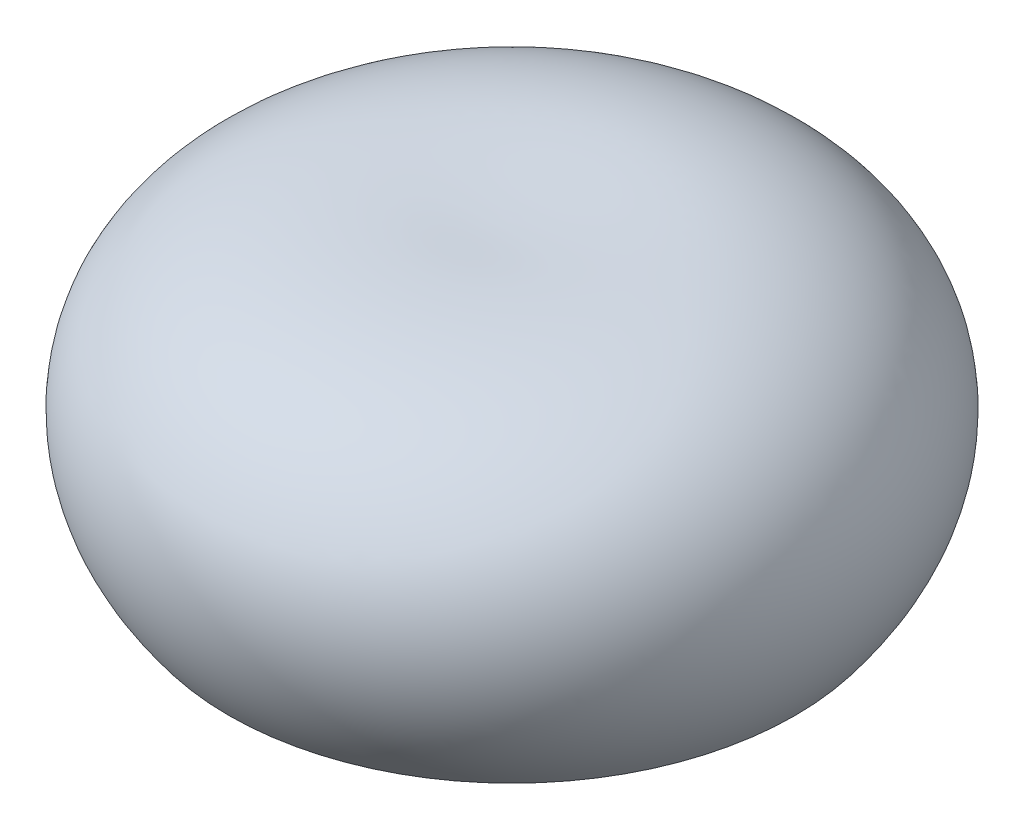
from build123d import *


with BuildPart() as part:
    # 草图1 → 旋转1 (revolve)
    with BuildSketch(Plane.XY):
        with BuildLine():
            Line((0, 7), (0, 0))
            Line((0, 0), (6.831441261, 0))
            add(Edge.make_bspline(
                [(0, 7), (0.073826027, 6.99961248), (0.178309524, 6.999064037), (0.306353289, 7.001245912), (0.380494798, 7.002863842), (0.441570297, 7.004497041), (0.495006805, 7.006121221), (0.543211062, 7.007739734), (0.587527277, 7.009349058), (0.628802834, 7.010947825), (0.667614606, 7.012534752), (0.704377034, 7.01410898), (0.739400045, 7.015669846), (0.772922733, 7.017216861), (0.805134201, 7.018749647), (0.83618711, 7.020267916), (0.866206819, 7.021771443), (0.895297775, 7.023260054), (0.923548095, 7.024733613), (0.951032931, 7.026192009), (0.977816991, 7.027635168), (1.003956462, 7.029063019), (1.029500501, 7.030475521), (1.054492406, 7.031872635), (1.078970545, 7.033254337), (1.10296911, 7.034620614), (1.126518722, 7.035971457), (1.149646932, 7.037306863), (1.172378634, 7.038626836), (1.194736407, 7.039931383), (1.216740809, 7.041220517), (1.238410615, 7.042494251), (1.25976303, 7.0437526), (1.280813862, 7.044995589), (1.301577678, 7.046223234), (1.322067936, 7.047435562), (1.342297094, 7.048632594), (1.362276717, 7.049814357), (1.382017559, 7.050980881), (1.401529643, 7.052132189), (1.420822325, 7.053268312), (1.439904357, 7.054389279), (1.458783938, 7.055495119), (1.477468763, 7.056585861), (1.495966064, 7.057661539), (1.514282646, 7.058722181), (1.532424926, 7.059767819), (1.550398957, 7.060798482), (1.568210462, 7.061814207), (1.585864853, 7.062815017), (1.603367259, 7.063800952), (1.62072254, 7.064772037), (1.637935314, 7.065728308), (1.655009966, 7.066669794), (1.671950667, 7.067596524), (1.68876139, 7.068508536), (1.705445919, 7.069405855), (1.722007866, 7.070288514), (1.738450677, 7.071156547), (1.754777643, 7.072009978), (1.770991912, 7.072848845), (1.787096497, 7.073673172), (1.803094282, 7.074482995), (1.81898803, 7.075278339), (1.834780391, 7.076059237), (1.850473907, 7.076825718), (1.86607102, 7.077577811), (1.881574075, 7.078315544), (1.896985327, 7.079038948), (1.912306943, 7.07974805), (1.927541011, 7.080442881), (1.94268954, 7.081123467), (1.957754466, 7.081789835), (1.972737654, 7.082442017), (1.987640906, 7.083080038), (2.002465956, 7.083703922), (2.017214482, 7.084313704), (2.031888102, 7.084909403), (2.046488381, 7.085491048), (2.06101683, 7.086058669), (2.075474911, 7.086612287), (2.089864039, 7.087151929), (2.104185584, 7.087677622), (2.118440871, 7.088189393), (2.132631183, 7.088687262), (2.146757765, 7.089171256), (2.160821822, 7.089641403), (2.174824525, 7.090097722), (2.188767006, 7.09054024), (2.202650367, 7.09096898), (2.216475676, 7.091383966), (2.23024397, 7.091785222), (2.243956256, 7.092172768), (2.257613513, 7.092546632), (2.271216693, 7.092906831), (2.284766719, 7.093253391), (2.298264492, 7.093586334), (2.311710885, 7.09390568), (2.32510675, 7.094211452), (2.338452915, 7.094503671), (2.351750186, 7.094782357), (2.364999348, 7.095047533), (2.378201166, 7.09529922), (2.391356385, 7.095537436), (2.404465731, 7.095762203), (2.417529911, 7.09597354), (2.430549615, 7.096171469), (2.443525516, 7.096356007), (2.45645827, 7.096527175), (2.469348518, 7.09668499), (2.482196883, 7.096829475), (2.495003975, 7.096960644), (2.50777039, 7.097078519), (2.520496708, 7.097183115), (2.533183498, 7.097274453), (2.545831313, 7.097352551), (2.558440695, 7.097417424), (2.571012173, 7.097469092), (2.583546264, 7.09750757), (2.596043474, 7.097532877), (2.608504298, 7.097545029), (2.620929218, 7.097544042), (2.633318709, 7.097529932), (2.64567323, 7.097502718), (2.657993237, 7.097462414), (2.67027917, 7.097409035), (2.682531464, 7.097342598), (2.694750544, 7.09726312), (2.706936823, 7.097170612), (2.719090708, 7.097065093), (2.731212598, 7.096946574), (2.743302883, 7.096815074), (2.755361945, 7.096670604), (2.767390158, 7.096513182), (2.779387888, 7.096342817), (2.791355496, 7.096159528), (2.803293333, 7.095963325), (2.815201745, 7.095754224), (2.827081071, 7.095532236), (2.838931641, 7.095297379), (2.850753782, 7.095049659), (2.862547814, 7.094789094), (2.874314048, 7.094515696), (2.886052794, 7.094229477), (2.89776435, 7.093930449), (2.909449014, 7.093618625), (2.921107076, 7.093294014), (2.932738821, 7.092956632), (2.944344528, 7.092606489), (2.955924471, 7.092243596), (2.967478921, 7.091867965), (2.979008141, 7.091479607), (2.990512392, 7.091078535), (3.001991929, 7.090664754), (3.013447002, 7.090238283), (3.024877857, 7.089799124), (3.036284736, 7.089347295), (3.047667878, 7.088882802), (3.059027515, 7.088405656), (3.070363877, 7.087915865), (3.081677189, 7.087413443), (3.092967672, 7.086898398), (3.104235546, 7.086370736), (3.115481023, 7.085830472), (3.126704315, 7.085277611), (3.137905628, 7.084712164), (3.149085165, 7.084134138), (3.160243127, 7.083543545), (3.171379711, 7.08294039), (3.18249511, 7.082324685), (3.193589514, 7.081696437), (3.204663111, 7.081055651), (3.215716085, 7.080402341), (3.226748617, 7.079736509), (3.237760886, 7.079058168), (3.248753066, 7.078367321), (3.25972533, 7.077663979), (3.270677849, 7.076948147), (3.28161079, 7.076219835), (3.292524317, 7.075479047), (3.303418592, 7.074725791), (3.314293774, 7.073960076), (3.325150021, 7.073181906), (3.335987487, 7.072391289), (3.346806324, 7.071588229), (3.357606682, 7.070772736), (3.368388709, 7.069944815), (3.379152549, 7.069104471), (3.389898346, 7.068251711), (3.40062624, 7.067386539), (3.411336371, 7.066508962), (3.422028874, 7.065618987), (3.432703885, 7.064716619), (3.443361536, 7.063801859), (3.454001959, 7.062874719), (3.46462528, 7.061935199), (3.475231627, 7.060983306), (3.485821126, 7.060019045), (3.496393899, 7.059042419), (3.506950067, 7.058053435), (3.51748975, 7.057052097), (3.528013066, 7.056038409), (3.53852013, 7.055012375), (3.549011057, 7.053973998), (3.559485961, 7.052923283), (3.569944951, 7.051860236), (3.580388137, 7.050784859), (3.590815628, 7.049697155), (3.60122753, 7.04859713), (3.611623946, 7.047484783), (3.622004982, 7.046360123), (3.632370739, 7.04522315), (3.642721317, 7.044073867), (3.653056816, 7.042912278), (3.663377333, 7.041738386), (3.673682964, 7.040552194), (3.683973805, 7.039353704), (3.694249949, 7.038142919), (3.704511488, 7.036919842), (3.714758514, 7.035684475), (3.724991116, 7.03443682), (3.735209383, 7.033176878), (3.745413403, 7.031904655), (3.75560326, 7.03062015), (3.765779041, 7.029323364), (3.775940829, 7.028014301), (3.786088707, 7.026692964), (3.796222756, 7.025359352), (3.806343057, 7.024013466), (3.816449688, 7.02265531), (3.826542729, 7.021284883), (3.836622256, 7.019902188), (3.846688346, 7.018507226), (3.856741073, 7.017099995), (3.866780512, 7.015680502), (3.876806735, 7.01424874), (3.886819815, 7.012804716), (3.896819824, 7.01134843), (3.90680683, 7.009879879), (3.916780903, 7.008399066), (3.926742113, 7.006905992), (3.936690524, 7.005400655), (3.946626205, 7.003883057), (3.956549222, 7.002353198), (3.966459637, 7.000811077), (3.976357517, 6.999256695), (3.986242922, 6.997690051), (3.996115917, 6.996111144), (4.005976561, 6.994519976), (4.015824916, 6.992916545), (4.02566104, 6.991300851), (4.035484994, 6.989672893), (4.045296834, 6.988032669), (4.055096619, 6.986380181), (4.064884405, 6.984715427), (4.074660248, 6.983038404), (4.084424202, 6.981349114), (4.094176323, 6.979647555), (4.103916663, 6.977933724), (4.113645276, 6.976207622), (4.123362214, 6.974469247), (4.133067528, 6.972718596), (4.142761269, 6.970955668), (4.152443487, 6.969180463), (4.162114232, 6.967392978), (4.171773552, 6.965593212), (4.181421496, 6.963781161), (4.191058111, 6.961956825), (4.200683444, 6.960120203), (4.210297541, 6.958271289), (4.219900448, 6.956410085), (4.229492209, 6.954536586), (4.239072869, 6.95265079), (4.248642473, 6.950752695), (4.258201062, 6.948842299), (4.267748681, 6.946919598), (4.277285369, 6.94498459), (4.286811171, 6.943037272), (4.296326125, 6.941077643), (4.305830272, 6.939105696), (4.315323653, 6.937121433), (4.324806306, 6.935124847), (4.334278271, 6.933115936), (4.343739584, 6.931094697), (4.353190285, 6.929061127), (4.36263041, 6.927015222), (4.372059995, 6.924956978), (4.381479078, 6.922886393), (4.390887692, 6.920803462), (4.400285874, 6.918708182), (4.409673658, 6.916600549), (4.419051079, 6.914480559), (4.42841817, 6.912348208), (4.437774964, 6.910203491), (4.447121494, 6.908046408), (4.456457791, 6.905876949), (4.465783889, 6.903695116), (4.475099817, 6.901500898), (4.484405608, 6.899294297), (4.493701291, 6.897075303), (4.502986897, 6.894843915), (4.512262455, 6.892600126), (4.521527995, 6.890343936), (4.530783544, 6.888075334), (4.540029131, 6.885794319), (4.549264784, 6.883500886), (4.55849053, 6.881195028), (4.567706398, 6.878876743), (4.576912412, 6.876546022), (4.5861086, 6.874202864), (4.595294987, 6.871847261), (4.604471599, 6.869479209), (4.61363846, 6.8670987), (4.622795596, 6.864705731), (4.63194303, 6.862300299), (4.641080787, 6.859882391), (4.65020889, 6.85745201), (4.659327362, 6.855009142), (4.668436227, 6.852553788), (4.677535505, 6.850085939), (4.686625221, 6.847605588), (4.695705394, 6.845112732), (4.704776047, 6.842607362), (4.713837201, 6.840089474), (4.722888876, 6.83755906), (4.731931092, 6.835016114), (4.740963871, 6.832460632), (4.74998723, 6.829892604), (4.75900119, 6.827312027), (4.768005769, 6.824718891), (4.777000986, 6.822113193), (4.785986859, 6.819494921), (4.794963407, 6.816864075), (4.803930647, 6.814220643), (4.812888596, 6.811564621), (4.821837272, 6.808895998), (4.830776691, 6.806214774), (4.839706869, 6.803520935), (4.848627822, 6.800814476), (4.857539568, 6.798095391), (4.866442119, 6.795363672), (4.875335493, 6.792619313), (4.884219704, 6.789862302), (4.893094767, 6.787092637), (4.901960695, 6.784310306), (4.910817504, 6.781515306), (4.919665205, 6.778707625), (4.928503814, 6.775887257), (4.937333343, 6.773054194), (4.946153805, 6.770208428), (4.954965213, 6.767349953), (4.963767579, 6.764478756), (4.972560915, 6.761594835), (4.981345232, 6.758698176), (4.990120543, 6.755788775), (4.998886858, 6.752866623), (5.007644188, 6.74993171), (5.016392546, 6.746984029), (5.025131939, 6.744023569), (5.033862379, 6.741050326), (5.042583876, 6.738064287), (5.051296439, 6.735065448), (5.060000077, 6.732053794), (5.068694801, 6.729029321), (5.077380618, 6.725992018), (5.086057538, 6.722941878), (5.094725569, 6.71987889), (5.103384718, 6.716803044), (5.112034995, 6.713714334), (5.120676405, 6.710612749), (5.129308958, 6.70749828), (5.137932659, 6.704370916), (5.146547516, 6.701230651), (5.155153537, 6.698077474), (5.163750726, 6.694911373), (5.17233909, 6.691732342), (5.180918636, 6.688540369), (5.189489369, 6.685335446), (5.198051295, 6.682117563), (5.206604418, 6.678886708), (5.215148744, 6.675642873), (5.223684278, 6.672386047), (5.232211025, 6.669116222), (5.240728988, 6.665833385), (5.249238171, 6.662537528), (5.25773858, 6.659228639), (5.266230218, 6.65590671), (5.274713087, 6.652571728), (5.283187193, 6.649223684), (5.291652536, 6.645862568), (5.300109121, 6.642488368), (5.308556949, 6.639101074), (5.316996024, 6.635700677), (5.325426348, 6.632287163), (5.333847922, 6.628860523), (5.342260749, 6.625420747), (5.350664829, 6.62196782), (5.359060165, 6.618501737), (5.367446757, 6.615022483), (5.375824607, 6.611530048), (5.384193715, 6.608024418), (5.392554082, 6.604505586), (5.400905709, 6.60097354), (5.409248594, 6.597428265), (5.417582739, 6.593869754), (5.425908142, 6.590297991), (5.434224804, 6.586712969), (5.442532724, 6.583114673), (5.450831901, 6.579503092), (5.459122334, 6.575878214), (5.467404022, 6.572240029), (5.475676964, 6.568588524), (5.483941157, 6.564923686), (5.492196599, 6.561245503), (5.50044329, 6.557553965), (5.508681226, 6.553849056), (5.516910406, 6.550130769), (5.525130826, 6.546399086), (5.533342485, 6.542653999), (5.541545379, 6.538895494), (5.549739504, 6.535123557), (5.557924857, 6.531338176), (5.566101436, 6.527539342), (5.574269235, 6.523727037), (5.582428252, 6.519901252), (5.590578482, 6.516061971), (5.598719922, 6.512209184), (5.606852565, 6.508342875), (5.61497641, 6.504463035), (5.623091449, 6.500569647), (5.631197678, 6.496662699), (5.639295091, 6.492742179), (5.647383684, 6.488808072), (5.655463452, 6.484860367), (5.663534387, 6.480899047), (5.671596486, 6.476924101), (5.679649739, 6.472935514), (5.687694144, 6.468933274), (5.695729692, 6.464917367), (5.703756377, 6.460887777), (5.711774192, 6.456844492), (5.71978313, 6.452787497), (5.727783185, 6.44871678), (5.735774348, 6.444632324), (5.743756613, 6.440534118), (5.751729971, 6.436422145), (5.759694415, 6.432296392), (5.767649937, 6.428156845), (5.775596528, 6.424003489), (5.783534181, 6.41983631), (5.791462886, 6.415655292), (5.799382636, 6.411460423), (5.807293419, 6.407251684), (5.81519523, 6.403029064), (5.823088058, 6.398792549), (5.830971892, 6.394542118), (5.838846725, 6.390277764), (5.846712546, 6.385999466), (5.854569345, 6.381707212), (5.862417112, 6.377400984), (5.870255837, 6.37308077), (5.878085509, 6.368746552), (5.885906118, 6.364398316), (5.893717654, 6.360036046), (5.901520105, 6.355659726), (5.90931346, 6.351269342), (5.917097708, 6.346864875), (5.924872839, 6.342446315), (5.932638837, 6.338013638), (5.940395695, 6.333566835), (5.948143398, 6.329105888), (5.955881936, 6.324630778), (5.963611296, 6.320141494), (5.971331465, 6.315638016), (5.97904243, 6.311120327), (5.98674418, 6.306588415), (5.994436701, 6.302042259), (6.002119979, 6.297481844), (6.009794004, 6.292907155), (6.017458758, 6.288318172), (6.02511423, 6.283714882), (6.032760407, 6.279097266), (6.040397273, 6.274465306), (6.048024816, 6.269818988), (6.05564302, 6.265158293), (6.06325187, 6.260483203), (6.070851354, 6.255793703), (6.078441456, 6.251089774), (6.08602216, 6.246371399), (6.093593452, 6.241638561), (6.101155317, 6.236891242), (6.108707739, 6.232129424), (6.116250702, 6.22735309), (6.123784191, 6.222562222), (6.13130819, 6.217756803), (6.138822681, 6.212936811), (6.146327653, 6.208102235), (6.153823082, 6.203253049), (6.161308958, 6.198389242), (6.16878526, 6.19351079), (6.176251974, 6.188617678), (6.183709081, 6.183709887), (6.191156565, 6.178787397), (6.198594407, 6.173850191), (6.206022591, 6.168898249), (6.213441098, 6.163931553), (6.220849911, 6.158950084), (6.228249012, 6.153953824), (6.235638381, 6.148942751), (6.243018001, 6.143916849), (6.250387854, 6.138876098), (6.25774792, 6.133820477), (6.26509818, 6.128749968), (6.272438616, 6.123664551), (6.279769208, 6.118564209), (6.287089935, 6.113448917), (6.294400781, 6.10831866), (6.301701724, 6.103173416), (6.308992744, 6.098013165), (6.316273821, 6.092837888), (6.323544934, 6.087647564), (6.330806063, 6.082442172), (6.33805719, 6.077221696), (6.345298289, 6.071986108), (6.352529345, 6.066735396), (6.359750331, 6.061469533), (6.36696123, 6.056188501), (6.374162017, 6.050892278), (6.381352675, 6.045580846), (6.388533176, 6.040254179), (6.395703504, 6.034912262), (6.402863633, 6.029555069), (6.410013542, 6.024182581), (6.417153208, 6.018794776), (6.424282608, 6.013391631), (6.431401721, 6.007973128), (6.438510521, 6.002539242), (6.445608988, 5.997089955), (6.452697094, 5.991625239), (6.459774821, 5.98614508), (6.466842141, 5.980649449), (6.473899031, 5.975138327), (6.480945468, 5.969611692), (6.487981427, 5.964069521), (6.495006884, 5.95851179), (6.502021813, 5.95293848), (6.50902619, 5.947349564), (6.51601999, 5.941745023), (6.523003188, 5.936124831), (6.529975758, 5.930488968), (6.536937674, 5.924837409), (6.543888912, 5.91917013), (6.550829444, 5.91348711), (6.557759247, 5.907788324), (6.56467829, 5.902073748), (6.57158655, 5.896343361), (6.578483999, 5.890597136), (6.585370611, 5.884835051), (6.592246357, 5.879057081), (6.599111213, 5.873263203), (6.605965148, 5.867453391), (6.612808137, 5.861627622), (6.619640151, 5.855785872), (6.626461162, 5.849928114), (6.633271142, 5.844054327), (6.640070062, 5.838164483), (6.646857895, 5.832258559), (6.65363461, 5.826336527), (6.66040018, 5.820398366), (6.667154576, 5.814444048), (6.673897766, 5.808473547), (6.680629723, 5.802486841), (6.687350415, 5.7964839), (6.694059815, 5.790464702), (6.700757891, 5.784429218), (6.707444612, 5.778377424), (6.714119949, 5.772309292), (6.72078387, 5.766224797), (6.727436346, 5.760123913), (6.734077343, 5.754006611), (6.740706832, 5.747872867), (6.747324779, 5.741722653), (6.753931155, 5.735555942), (6.760525926, 5.729372706), (6.767109061, 5.72317292), (6.773680527, 5.716956554), (6.780240291, 5.710723583), (6.786788322, 5.704473979), (6.793324585, 5.698207711), (6.799849047, 5.691924755), (6.806361676, 5.685625081), (6.812862436, 5.679308661), (6.819351296, 5.672975467), (6.82582822, 5.66662547), (6.832293173, 5.660258641), (6.838746122, 5.653874952), (6.845187032, 5.647474375), (6.851615868, 5.641056878), (6.858032594, 5.634622434), (6.864437176, 5.628171013), (6.870829578, 5.621702586), (6.877209762, 5.615217122), (6.883577694, 5.608714591), (6.889933338, 5.602194965), (6.896276656, 5.595658212), (6.902607613, 5.589104304), (6.908926169, 5.582533207), (6.915232291, 5.575944892), (6.921525938, 5.569339329), (6.927807074, 5.562716486), (6.93407566, 5.556076332), (6.940331659, 5.549418835), (6.946575032, 5.542743965), (6.95280574, 5.536051689), (6.959023744, 5.529341976), (6.965229006, 5.522614794), (6.971421487, 5.515870111), (6.977601144, 5.509107892), (6.983767942, 5.502328109), (6.989921836, 5.495530725), (6.996062789, 5.488715709), (7.00219076, 5.481883029), (7.008305706, 5.47503265), (7.014407587, 5.468164539), (7.020496364, 5.461278663), (7.026571991, 5.454374986), (7.03263443, 5.447453477), (7.038683638, 5.440514101), (7.04471957, 5.433556822), (7.050742184, 5.426581606), (7.056751441, 5.41958842), (7.062747294, 5.412577226), (7.0687297, 5.405547991), (7.074698615, 5.398500679), (7.080653997, 5.391435254), (7.086595799, 5.384351681), (7.092523978, 5.377249924), (7.09843849, 5.370129945), (7.104339288, 5.36299171), (7.110226328, 5.355835181), (7.116099562, 5.348660321), (7.121958947, 5.341467093), (7.127804434, 5.33425546), (7.133635978, 5.327025384), (7.139453534, 5.319776829), (7.145257051, 5.312509755), (7.151046484, 5.305224124), (7.156821783, 5.297919898), (7.162582904, 5.29059704), (7.168329793, 5.283255507), (7.174062407, 5.275895265), (7.179780693, 5.268516269), (7.185484603, 5.261118484), (7.19117409, 5.253701868), (7.196849099, 5.246266381), (7.202509584, 5.238811984), (7.208155493, 5.231338634), (7.213786775, 5.223846292), (7.219403379, 5.216334916), (7.225005254, 5.208804466), (7.230592346, 5.201254898), (7.236164607, 5.193686173), (7.24172198, 5.186098246), (7.247264415, 5.178491076), (7.252791858, 5.17086462), (7.258304256, 5.163218835), (7.263801554, 5.155553678), (7.269283698, 5.147869105), (7.274750635, 5.140165073), (7.280202309, 5.132441536), (7.285638665, 5.124698453), (7.291059647, 5.116935776), (7.296465199, 5.109153462), (7.301855266, 5.101351464), (7.307229789, 5.093529737), (7.312588712, 5.085688236), (7.31793198, 5.077826914), (7.323259529, 5.069945724), (7.328571308, 5.062044622), (7.333867255, 5.054123557), (7.339147311, 5.046182484), (7.344411415, 5.038221353), (7.349659511, 5.03024012), (7.354891536, 5.022238732), (7.360107432, 5.014217142), (7.365307135, 5.006175301), (7.370490586, 4.99811316), (7.375657723, 4.990030668), (7.380808483, 4.981927776), (7.385942803, 4.973804433), (7.39106062, 4.965660587), (7.396161874, 4.957496189), (7.401246496, 4.949311186), (7.406314425, 4.941105526), (7.411365595, 4.932879156), (7.416399942, 4.924632025), (7.4214174, 4.916364079), (7.426417902, 4.908075264), (7.431401383, 4.899765528), (7.436367773, 4.891434813), (7.441317009, 4.883083068), (7.44624902, 4.874710235), (7.451163738, 4.866316261), (7.456061095, 4.85790109), (7.460941021, 4.849464663), (7.465803446, 4.841006925), (7.470648302, 4.832527819), (7.475475515, 4.824027287), (7.480285016, 4.815505271), (7.485076733, 4.806961712), (7.48985059, 4.79839655), (7.494606521, 4.789809729), (7.499344447, 4.781201186), (7.504064297, 4.772570863), (7.508765993, 4.763918695), (7.513449467, 4.755244626), (7.518114636, 4.74654859), (7.522761429, 4.737830527), (7.527389767, 4.729090373), (7.531999574, 4.720328065), (7.536590772, 4.71154354), (7.541163283, 4.702736733), (7.545717027, 4.693907579), (7.550251926, 4.685056012), (7.5547679, 4.676181967), (7.559264867, 4.667285378), (7.563742748, 4.658366177), (7.568201459, 4.649424296), (7.572640919, 4.640459668), (7.577061042, 4.631472224), (7.581461751, 4.622461894), (7.585842955, 4.613428609), (7.590204571, 4.604372298), (7.594546516, 4.595292891), (7.5988687, 4.586190314), (7.603171038, 4.577064496), (7.607453444, 4.567915364), (7.611715826, 4.558742845), (7.615958098, 4.549546864), (7.620180171, 4.540327347), (7.624381949, 4.531084217), (7.628563348, 4.521817399), (7.632724272, 4.512526815), (7.63686463, 4.503212389), (7.640984331, 4.493874042), (7.645083274, 4.484511694), (7.649161372, 4.475125267), (7.653218524, 4.465714678), (7.657254638, 4.45627985), (7.661269612, 4.446820696), (7.665263355, 4.437337138), (7.66923576, 4.427829089), (7.673186735, 4.418296467), (7.677116175, 4.408739186), (7.68102398, 4.39915716), (7.68491005, 4.389550304), (7.688774278, 4.379918528), (7.692616567, 4.370261746), (7.696436804, 4.360579866), (7.700234889, 4.350872801), (7.704010715, 4.341140458), (7.707764174, 4.331382747), (7.711495158, 4.321599574), (7.715203559, 4.311790846), (7.718889263, 4.301956468), (7.722552163, 4.292096345), (7.726192146, 4.28221038), (7.729809098, 4.272298475), (7.733402908, 4.262360534), (7.736973454, 4.252396454), (7.740520629, 4.242406139), (7.744044308, 4.232389483), (7.747544379, 4.222346387), (7.751020719, 4.212276746), (7.754473208, 4.202180455), (7.757901727, 4.19205741), (7.76130615, 4.181907501), (7.764686357, 4.171730623), (7.76804222, 4.161526665), (7.771373615, 4.151295518), (7.774680415, 4.14103707), (7.77796249, 4.130751209), (7.781219711, 4.120437819), (7.784451948, 4.110096786), (7.787659069, 4.099727995), (7.79084094, 4.089331325), (7.793997427, 4.07890666), (7.797128393, 4.068453878), (7.800233702, 4.057972858), (7.803313213, 4.047463476), (7.80636679, 4.036925609), (7.809394288, 4.02635913), (7.812395566, 4.015763911), (7.815370481, 4.005139825), (7.818318884, 3.99448674), (7.821240631, 3.983804525), (7.824135572, 3.973093046), (7.827003555, 3.962352168), (7.829844432, 3.951581755), (7.832658048, 3.940781669), (7.835444246, 3.929951769), (7.838202873, 3.919091914), (7.84093377, 3.908201962), (7.843636775, 3.897281765), (7.846311728, 3.886331179), (7.848958465, 3.875350054), (7.851576822, 3.86433824), (7.854166632, 3.853295584), (7.856727724, 3.842221932), (7.859259931, 3.831117129), (7.861763079, 3.819981015), (7.864236993, 3.808813431), (7.866681497, 3.797614214), (7.869096413, 3.7863832), (7.87148156, 3.775120223), (7.873836757, 3.763825113), (7.876161817, 3.7524977), (7.878456556, 3.74113781), (7.880720784, 3.729745269), (7.882954312, 3.718319898), (7.885156942, 3.706861517), (7.887328483, 3.695369944), (7.889468735, 3.683844992), (7.891577499, 3.672286475), (7.893654571, 3.660694203), (7.895699747, 3.649067982), (7.897712819, 3.637407617), (7.899693575, 3.625712909), (7.901641805, 3.613983657), (7.903557292, 3.602219657), (7.905439817, 3.590420703), (7.907289162, 3.578586584), (7.9091051, 3.566717086), (7.910887405, 3.554811995), (7.912635851, 3.542871091), (7.914350199, 3.530894151), (7.91603022, 3.51888095), (7.917675669, 3.506831258), (7.91928631, 3.494744842), (7.920861894, 3.482621466), (7.922402172, 3.470460891), (7.923906896, 3.458262873), (7.925375808, 3.446027165), (7.92680865, 3.433753515), (7.928205158, 3.421441669), (7.92956507, 3.409091368), (7.930888111, 3.396702347), (7.93217401, 3.38427434), (7.93342249, 3.371807076), (7.934633269, 3.359300277), (7.935806061, 3.346753663), (7.936940577, 3.33416695), (7.93803652, 3.321539846), (7.939093596, 3.308872058), (7.940111499, 3.296163285), (7.941089923, 3.283413222), (7.942028554, 3.27062156), (7.942927078, 3.257787983), (7.943785171, 3.24491217), (7.944602506, 3.231993794), (7.945378752, 3.219032525), (7.946113571, 3.206028022), (7.946806622, 3.192979944), (7.947457556, 3.179887938), (7.948066016, 3.16675165), (7.948631649, 3.153570715), (7.949154083, 3.140344763), (7.949632952, 3.12707342), (7.950067874, 3.1137563), (7.950458468, 3.100393013), (7.950804339, 3.086983161), (7.951105095, 3.073526339), (7.951360327, 3.060022132), (7.951569625, 3.046470119), (7.951732574, 3.03286987), (7.95184874, 3.019220947), (7.951917698, 3.005522904), (7.951938999, 2.991775283), (7.951912198, 2.97797762), (7.951836834, 2.964129441), (7.951712443, 2.950230261), (7.951538547, 2.936279586), (7.951314664, 2.922276911), (7.951040298, 2.908221721), (7.950714946, 2.894113489), (7.950338097, 2.879951678), (7.949909224, 2.865735739), (7.949427798, 2.851465112), (7.948893271, 2.837139222), (7.948305089, 2.822757483), (7.947662685, 2.808319297), (7.946965479, 2.79382405), (7.946212881, 2.779271115), (7.945404291, 2.764659852), (7.944539088, 2.749989604), (7.943616644, 2.7352597), (7.942636317, 2.720469453), (7.941597449, 2.705618158), (7.940499368, 2.690705095), (7.939341388, 2.675729526), (7.938122804, 2.660690694), (7.936842898, 2.645587824), (7.935500935, 2.63042012), (7.934096162, 2.615186768), (7.932627806, 2.599886933), (7.931095082, 2.584519755), (7.929497177, 2.569084356), (7.927833264, 2.553579833), (7.926102496, 2.538005257), (7.924303998, 2.522359677), (7.922436881, 2.506642114), (7.920500227, 2.490851563), (7.918493099, 2.47498699), (7.91641453, 2.459047331), (7.914263532, 2.443031495), (7.912039084, 2.426938356), (7.909740147, 2.410766757), (7.90736564, 2.394515506), (7.904914466, 2.378183376), (7.902385483, 2.361769102), (7.899777529, 2.345271379), (7.897089394, 2.328688866), (7.894319846, 2.312020174), (7.891467606, 2.295263874), (7.888531363, 2.278418489), (7.885509757, 2.261482494), (7.882401395, 2.244454315), (7.879204834, 2.227332324), (7.875918587, 2.210114836), (7.872541115, 2.192800111), (7.86907083, 2.175386346), (7.865506094, 2.157871675), (7.861845206, 2.140254165), (7.858086412, 2.122531812), (7.854227894, 2.104702538), (7.850267765, 2.086764187), (7.846204078, 2.068714521), (7.842034806, 2.050551215), (7.837757848, 2.032271854), (7.833371027, 2.013873922), (7.828872075, 1.995354807), (7.824258639, 1.976711784), (7.819528268, 1.957942018), (7.814678413, 1.93904255), (7.809706418, 1.920010292), (7.804609514, 1.900842023), (7.79938481, 1.881534374), (7.794029295, 1.862083822), (7.788539812, 1.842486682), (7.782913068, 1.822739092), (7.777145613, 1.802837003), (7.771233831, 1.782776166), (7.765173932, 1.762552117), (7.758961935, 1.742160165), (7.752593661, 1.721595371), (7.746064711, 1.70085253), (7.73937045, 1.679926154), (7.732505999, 1.658810446), (7.725466197, 1.637499277), (7.718245598, 1.61598616), (7.710838434, 1.594264216), (7.70323859, 1.572326145), (7.695439582, 1.550164183), (7.68743451, 1.527770068), (7.679216032, 1.505134986), (7.670776315, 1.482249523), (7.662106992, 1.459103603), (7.653199103, 1.435686425), (7.644043042, 1.411986383), (7.634628477, 1.387990983), (7.624944284, 1.363686743), (7.614978446, 1.33905908), (7.604717954, 1.314092184), (7.594148689, 1.28876886), (7.583255271, 1.263070361), (7.572020914, 1.236976177), (7.560427217, 1.210463798), (7.548453948, 1.18350843), (7.536078766, 1.156082653), (7.52327691, 1.128156017), (7.510020795, 1.099694549), (7.496279544, 1.070660156), (7.482018409, 1.041009885), (7.467198033, 1.010695011), (7.451773557, 0.979659882), (7.43569345, 0.947840457), (7.418898027, 0.915162416), (7.401317504, 0.88153868), (7.382869392, 0.846866107), (7.363454982, 0.811020992), (7.342954436, 0.773852795), (7.321219775, 0.735175152), (7.298064541, 0.694752576), (7.273247917, 0.652279979), (7.246449153, 0.607349576), (7.217223809, 0.559393937), (7.184922391, 0.507579711), (7.148521469, 0.450584621), (7.106203239, 0.386040398), (7.053928975, 0.3085951), (6.962588145, 0.177853211), (6.88558457, 0.073425773), (6.831441261, 0)],
                knots=[0, 0, 0, 0, 0.016508251, 0.023363574, 0.028636216, 0.033091617, 0.037025983, 0.04059109, 0.04387702, 0.046942414, 0.049827967, 0.052563282, 0.055170689, 0.057667517, 0.060067538, 0.062381906, 0.064619804, 0.066788902, 0.068895681, 0.070945675, 0.072943656, 0.07489377, 0.076799649, 0.078664492, 0.080491139, 0.082282118, 0.084039697, 0.085765916, 0.087462619, 0.08913148, 0.090774023, 0.092391639, 0.093985605, 0.095557094, 0.097107186, 0.09863688, 0.1001471, 0.101638706, 0.103112495, 0.104569211, 0.10600955, 0.107434162, 0.108843656, 0.110238603, 0.111619541, 0.112986976, 0.114341384, 0.115683217, 0.117012898, 0.118330831, 0.119637397, 0.120932958, 0.122217857, 0.123492421, 0.12475696, 0.126011769, 0.127257131, 0.128493315, 0.129720577, 0.130939162, 0.132149305, 0.13335123, 0.134545153, 0.13573128, 0.136909808, 0.138080926, 0.139244818, 0.140401657, 0.141551613, 0.142694847, 0.143831516, 0.144961768, 0.14608575, 0.1472036, 0.148315453, 0.14942144, 0.150521684, 0.151616309, 0.15270543, 0.153789161, 0.154867612, 0.155940888, 0.157009093, 0.158072325, 0.159130682, 0.160184256, 0.161233138, 0.162277417, 0.163317176, 0.1643525, 0.165383468, 0.166410158, 0.167432647, 0.168451008, 0.169465312, 0.17047563, 0.17148203, 0.172484577, 0.173483335, 0.174478368, 0.175469736, 0.176457499, 0.177441714, 0.178422438, 0.179399726, 0.180373632, 0.181344207, 0.182311504, 0.183275571, 0.184236458, 0.185194213, 0.18614888, 0.187100506, 0.188049136, 0.188994811, 0.189937576, 0.19087747, 0.191814535, 0.192748809, 0.193680333, 0.194609143, 0.195535276, 0.19645877, 0.197379659, 0.198297978, 0.199213761, 0.200127042, 0.201037853, 0.201946226, 0.202852193, 0.203755784, 0.204657029, 0.205555959, 0.206452602, 0.207346986, 0.208239139, 0.209129089, 0.210016863, 0.210902486, 0.211785985, 0.212667385, 0.213546711, 0.214423987, 0.215299238, 0.216172487, 0.217043757, 0.217913071, 0.218780451, 0.219645919, 0.220509497, 0.221371207, 0.222231068, 0.223089102, 0.223945328, 0.224799767, 0.225652438, 0.22650336, 0.227352552, 0.228200033, 0.22904582, 0.229889932, 0.230732387, 0.231573202, 0.232412394, 0.23324998, 0.234085976, 0.234920399, 0.235753266, 0.236584591, 0.237414391, 0.23824268, 0.239069475, 0.23989479, 0.240718639, 0.241541037, 0.242361999, 0.243181539, 0.24399967, 0.244816406, 0.245631761, 0.246445748, 0.247258379, 0.248069669, 0.248879629, 0.249688273, 0.250495612, 0.251301659, 0.252106427, 0.252909926, 0.253712168, 0.254513166, 0.255312931, 0.256111473, 0.256908805, 0.257704937, 0.25849988, 0.259293644, 0.260086241, 0.26087768, 0.261667972, 0.262457128, 0.263245156, 0.264032068, 0.264817873, 0.265602581, 0.266386201, 0.267168742, 0.267950215, 0.268730627, 0.26950999, 0.27028831, 0.271065598, 0.271841862, 0.272617111, 0.273391353, 0.274164597, 0.274936852, 0.275708125, 0.276478425, 0.277247759, 0.278016137, 0.278783566, 0.279550053, 0.280315607, 0.281080235, 0.281843945, 0.282606744, 0.283368639, 0.284129639, 0.28488975, 0.28564898, 0.286407335, 0.287164823, 0.287921451, 0.288677225, 0.289432153, 0.290186241, 0.290939495, 0.291691923, 0.292443531, 0.293194325, 0.293944313, 0.294693499, 0.295441891, 0.296189495, 0.296936317, 0.297682363, 0.298427639, 0.29917215, 0.299915904, 0.300658906, 0.301401162, 0.302142677, 0.302883457, 0.303623508, 0.304362835, 0.305101445, 0.305839342, 0.306576532, 0.30731302, 0.308048812, 0.308783913, 0.309518328, 0.310252063, 0.310985123, 0.311717512, 0.312449236, 0.3131803, 0.313910709, 0.314640467, 0.31536958, 0.316098053, 0.316825891, 0.317553097, 0.318279677, 0.319005636, 0.319730978, 0.320455708, 0.321179831, 0.32190335, 0.322626271, 0.323348598, 0.324070336, 0.324791488, 0.32551206, 0.326232055, 0.326951478, 0.327670332, 0.328388624, 0.329106355, 0.329823532, 0.330540157, 0.331256236, 0.331971771, 0.332686767, 0.333401229, 0.334115159, 0.334828562, 0.335541443, 0.336253804, 0.33696565, 0.337676984, 0.338387811, 0.339098134, 0.339807957, 0.340517283, 0.341226117, 0.341934462, 0.342642321, 0.343349699, 0.344056599, 0.344763024, 0.345468979, 0.346174466, 0.346879489, 0.347584052, 0.348288158, 0.34899181, 0.349695012, 0.350397768, 0.351100081, 0.351801953, 0.352503389, 0.353204392, 0.353904965, 0.354605111, 0.355304834, 0.356004137, 0.356703023, 0.357401495, 0.358099556, 0.35879721, 0.35949446, 0.360191309, 0.360887759, 0.361583815, 0.362279479, 0.362974754, 0.363669643, 0.36436415, 0.365058277, 0.365752027, 0.366445403, 0.367138409, 0.367831047, 0.36852332, 0.369215231, 0.369906783, 0.370597978, 0.37128882, 0.371979312, 0.372669456, 0.373359255, 0.374048713, 0.374737831, 0.375426612, 0.37611506, 0.376803177, 0.377490966, 0.37817843, 0.378865571, 0.379552391, 0.380238895, 0.380925084, 0.381610961, 0.382296529, 0.38298179, 0.383666747, 0.384351403, 0.385035761, 0.385719822, 0.386403589, 0.387087066, 0.387770254, 0.388453157, 0.389135776, 0.389818115, 0.390500176, 0.391181961, 0.391863473, 0.392544714, 0.393225687, 0.393906395, 0.39458684, 0.395267024, 0.39594695, 0.39662662, 0.397306037, 0.397985203, 0.398664121, 0.399342793, 0.400021221, 0.400699408, 0.401377357, 0.402055069, 0.402732547, 0.403409794, 0.404086811, 0.404763602, 0.405440168, 0.406116513, 0.406792637, 0.407468544, 0.408144236, 0.408819716, 0.409494985, 0.410170046, 0.410844901, 0.411519553, 0.412194003, 0.412868255, 0.41354231, 0.414216171, 0.41488984, 0.415563319, 0.416236611, 0.416909718, 0.417582642, 0.418255385, 0.41892795, 0.419600339, 0.420272553, 0.420944597, 0.42161647, 0.422288177, 0.422959719, 0.423631098, 0.424302316, 0.424973377, 0.425644281, 0.426315032, 0.426985631, 0.42765608, 0.428326383, 0.42899654, 0.429666555, 0.430336429, 0.431006165, 0.431675764, 0.43234523, 0.433014564, 0.433683769, 0.434352845, 0.435021797, 0.435690626, 0.436359334, 0.437027923, 0.437696396, 0.438364755, 0.439033001, 0.439701138, 0.440369167, 0.44103709, 0.44170491, 0.442372628, 0.443040248, 0.443707771, 0.444375199, 0.445042534, 0.445709779, 0.446376936, 0.447044007, 0.447710995, 0.4483779, 0.449044726, 0.449711475, 0.450378149, 0.451044749, 0.451711279, 0.452377741, 0.453044136, 0.453710466, 0.454376735, 0.455042944, 0.455709095, 0.456375191, 0.457041233, 0.457707224, 0.458373167, 0.459039062, 0.459704913, 0.460370722, 0.46103649, 0.461702221, 0.462367916, 0.463033577, 0.463699207, 0.464364808, 0.465030382, 0.465695931, 0.466361458, 0.467026964, 0.467692453, 0.468357925, 0.469023384, 0.469688832, 0.47035427, 0.471019702, 0.471685129, 0.472350554, 0.473015978, 0.473681405, 0.474346836, 0.475012273, 0.47567772, 0.476343178, 0.477008649, 0.477674136, 0.478339641, 0.479005166, 0.479670714, 0.480336286, 0.481001886, 0.481667516, 0.482333177, 0.482998872, 0.483664604, 0.484330375, 0.484996187, 0.485662042, 0.486327943, 0.486993892, 0.487659892, 0.488325944, 0.488992052, 0.489658218, 0.490324443, 0.490990731, 0.491657084, 0.492323504, 0.492989993, 0.493656555, 0.494323191, 0.494989904, 0.495656696, 0.49632357, 0.496990528, 0.497657573, 0.498324707, 0.498991932, 0.499659252, 0.500326668, 0.500994183, 0.5016618, 0.502329521, 0.502997348, 0.503665285, 0.504333333, 0.505001496, 0.505669775, 0.506338174, 0.507006695, 0.50767534, 0.508344112, 0.509013014, 0.509682049, 0.510351218, 0.511020525, 0.511689972, 0.512359562, 0.513029297, 0.513699181, 0.514369215, 0.515039403, 0.515709747, 0.516380251, 0.517050916, 0.517721745, 0.518392742, 0.519063908, 0.519735248, 0.520406763, 0.521078456, 0.52175033, 0.522422388, 0.523094633, 0.523767067, 0.524439694, 0.525112516, 0.525785536, 0.526458757, 0.527132183, 0.527805815, 0.528479657, 0.529153711, 0.529827982, 0.530502471, 0.531177181, 0.531852116, 0.532527279, 0.533202673, 0.5338783, 0.534554164, 0.535230268, 0.535906615, 0.536583208, 0.53726005, 0.537937144, 0.538614493, 0.539292101, 0.539969971, 0.540648106, 0.541326508, 0.542005183, 0.542684131, 0.543363358, 0.544042865, 0.544722657, 0.545402737, 0.546083107, 0.546763772, 0.547444735, 0.548125999, 0.548807567, 0.549489443, 0.55017163, 0.550854132, 0.551536953, 0.552220095, 0.552903562, 0.553587358, 0.554271486, 0.55495595, 0.555640753, 0.5563259, 0.557011393, 0.557697236, 0.558383433, 0.559069988, 0.559756904, 0.560444185, 0.561131835, 0.561819858, 0.562508256, 0.563197035, 0.563886198, 0.564575749, 0.565265692, 0.56595603, 0.566646768, 0.567337909, 0.568029458, 0.568721418, 0.569413794, 0.570106589, 0.570799808, 0.571493455, 0.572187533, 0.572882048, 0.573577002, 0.574272401, 0.574968249, 0.575664549, 0.576361306, 0.577058525, 0.57775621, 0.578454364, 0.579152994, 0.579852102, 0.580551693, 0.581251772, 0.581952344, 0.582653412, 0.583354982, 0.584057058, 0.584759644, 0.585462746, 0.586166368, 0.586870514, 0.58757519, 0.5882804, 0.588986149, 0.589692442, 0.590399283, 0.591106678, 0.591814632, 0.592523149, 0.593232235, 0.593941895, 0.594652133, 0.595362955, 0.596074366, 0.596786371, 0.597498975, 0.598212184, 0.598926003, 0.599640438, 0.600355493, 0.601071174, 0.601787486, 0.602504436, 0.603222028, 0.603940268, 0.604659162, 0.605378715, 0.606098933, 0.606819822, 0.607541388, 0.608263636, 0.608986572, 0.609710203, 0.610434533, 0.61115957, 0.611885319, 0.612611786, 0.613338978, 0.6140669, 0.61479556, 0.615524962, 0.616255114, 0.616986021, 0.617717691, 0.61845013, 0.619183344, 0.619917339, 0.620652124, 0.621387703, 0.622124085, 0.622861275, 0.623599281, 0.624338109, 0.625077767, 0.625818261, 0.626559598, 0.627301787, 0.628044833, 0.628788745, 0.629533529, 0.630279192, 0.631025743, 0.631773189, 0.632521537, 0.633270795, 0.634020971, 0.634772072, 0.635524106, 0.636277082, 0.637031006, 0.637785888, 0.638541735, 0.639298555, 0.640056357, 0.640815149, 0.641574939, 0.642335736, 0.643097548, 0.643860385, 0.644624254, 0.645389164, 0.646155124, 0.646922144, 0.647690232, 0.648459398, 0.649229649, 0.650000997, 0.65077345, 0.651547017, 0.652321708, 0.653097533, 0.653874501, 0.654652623, 0.655431908, 0.656212365, 0.656994006, 0.657776841, 0.658560879, 0.659346131, 0.660132607, 0.660920319, 0.661709277, 0.662499491, 0.663290972, 0.664083733, 0.664877782, 0.665673133, 0.666469796, 0.667267783, 0.668067105, 0.668867774, 0.669669802, 0.670473201, 0.671277983, 0.67208416, 0.672891744, 0.673700749, 0.674511186, 0.675323068, 0.676136408, 0.67695122, 0.677767515, 0.678585309, 0.679404613, 0.680225443, 0.68104781, 0.68187173, 0.682697217, 0.683524283, 0.684352945, 0.685183217, 0.686015112, 0.686848647, 0.687683836, 0.688520694, 0.689359237, 0.690199481, 0.69104144, 0.691885132, 0.692730572, 0.693577776, 0.694426762, 0.695277545, 0.696130143, 0.696984574, 0.697840853, 0.698699, 0.699559031, 0.700420965, 0.70128482, 0.702150614, 0.703018367, 0.703888097, 0.704759824, 0.705633566, 0.706509344, 0.707387177, 0.708267086, 0.709149092, 0.710033215, 0.710919476, 0.711807896, 0.712698498, 0.713591303, 0.714486333, 0.715383612, 0.716283161, 0.717185005, 0.718089166, 0.718995668, 0.719904537, 0.720815795, 0.721729469, 0.722645583, 0.723564164, 0.724485237, 0.725408828, 0.726334966, 0.727263675, 0.728194986, 0.729128925, 0.730065521, 0.731004803, 0.7319468, 0.732891544, 0.733839062, 0.734789388, 0.735742552, 0.736698585, 0.737657521, 0.738619392, 0.739584232, 0.740552074, 0.741522955, 0.742496908, 0.743473969, 0.744454175, 0.745437564, 0.746424172, 0.747414039, 0.748407202, 0.749403704, 0.750403582, 0.75140688, 0.752413639, 0.753423901, 0.754437711, 0.755455113, 0.756476152, 0.757500875, 0.758529328, 0.759561559, 0.760597618, 0.761637555, 0.762681419, 0.763729264, 0.764781142, 0.765837108, 0.766897216, 0.767961524, 0.769030088, 0.770102968, 0.771180223, 0.772261915, 0.773348108, 0.774438865, 0.775534251, 0.776634335, 0.777739184, 0.778848869, 0.779963461, 0.781083035, 0.782207666, 0.783337431, 0.784472409, 0.785612681, 0.786758331, 0.787909442, 0.789066103, 0.790228404, 0.791396435, 0.792570292, 0.793750071, 0.794935871, 0.796127795, 0.797325948, 0.798530437, 0.799741374, 0.800958872, 0.802183049, 0.803414025, 0.804651926, 0.805896879, 0.807149016, 0.808408474, 0.809675392, 0.810949915, 0.812232194, 0.813522381, 0.814820636, 0.816127124, 0.817442016, 0.818765486, 0.820097718, 0.8214389, 0.822789227, 0.824148902, 0.825518134, 0.826897142, 0.828286152, 0.829685398, 0.831095124, 0.832515586, 0.833947046, 0.835389779, 0.836844074, 0.838310228, 0.839788554, 0.841279378, 0.84278304, 0.844299896, 0.84583032, 0.847374703, 0.848933455, 0.850507006, 0.852095808, 0.853700338, 0.855321097, 0.856958612, 0.858613442, 0.860286175, 0.861977436, 0.863687885, 0.865418223, 0.867169194, 0.868941592, 0.87073626, 0.872554101, 0.874396079, 0.876263228, 0.878156657, 0.880077562, 0.88202723, 0.884007054, 0.886018541, 0.888063331, 0.890143212, 0.892260136, 0.894416246, 0.896613899, 0.898855701, 0.901144543, 0.903483648, 0.905876625, 0.908327542, 0.910841004, 0.913422269, 0.916077374, 0.918813316, 0.921638278, 0.924561926, 0.927595825, 0.930754002, 0.934053748, 0.937516794, 0.9411711, 0.945053679, 0.94921533, 0.953729132, 0.958707135, 0.964337724, 0.970987573, 0.979600573, 1, 1, 1, 1], degree=3))
        make_face()
    revolve(axis=Axis((0, 7, 0), (0, -1, 0)))

    # 草图2 → 切除-旋转1 (revolve, cut)
    with BuildSketch(Plane.XZ):
        with BuildLine():
            Line((0, 2), (0, -2))
            ThreePointArc((0, -2), (2, 0), (0, 2))
        make_face()
    revolve(axis=Axis((0, 0, 2), (0, 0, -1)), mode=Mode.SUBTRACT)


solid = part.part
